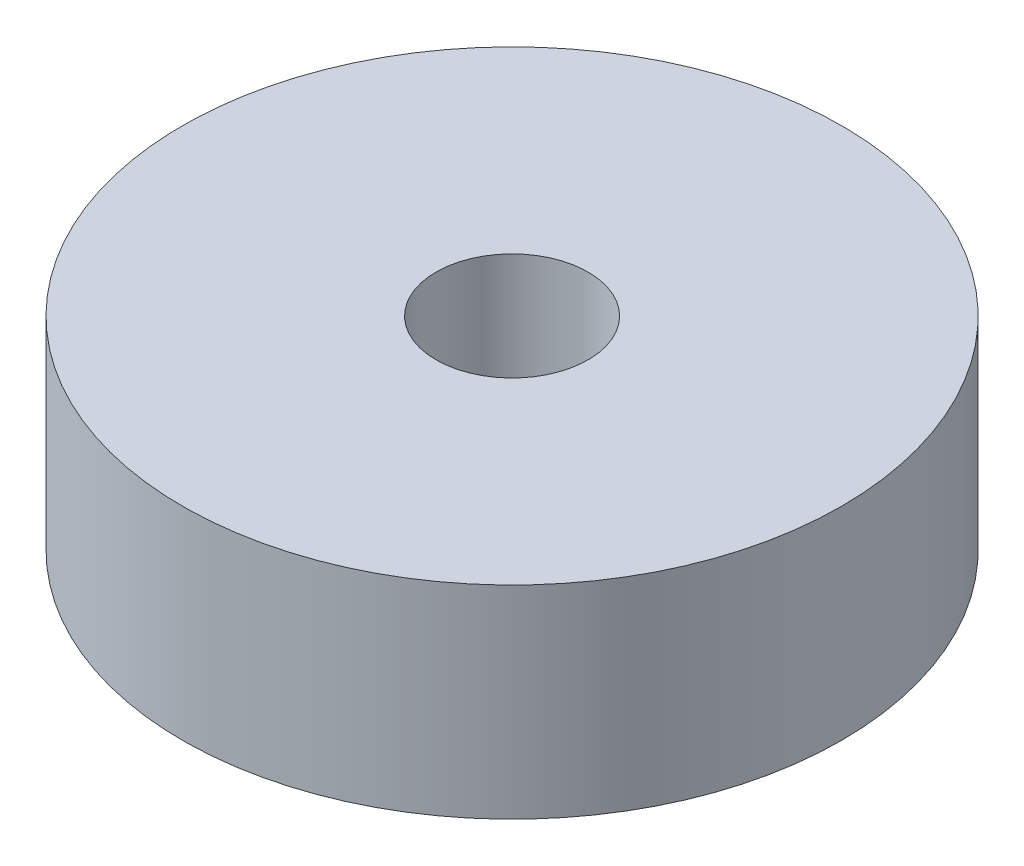
from build123d import *

# Parameters (mm, degrees)
SKETCH1_R           = 6.5
SKETCH1_R_2         = 1.5
EXTRUDE_THIN1_DEPTH = 4


with BuildPart() as part:
    # Sketch1 → Extrude-Thin1 (new body)
    with BuildSketch(Plane(origin=(0, 0, 0), x_dir=(1, 0, 0), z_dir=(0, 1, 0))):
        Circle(SKETCH1_R)
        Circle(SKETCH1_R_2, mode=Mode.SUBTRACT)
    extrude(amount=EXTRUDE_THIN1_DEPTH)


solid = part.part
